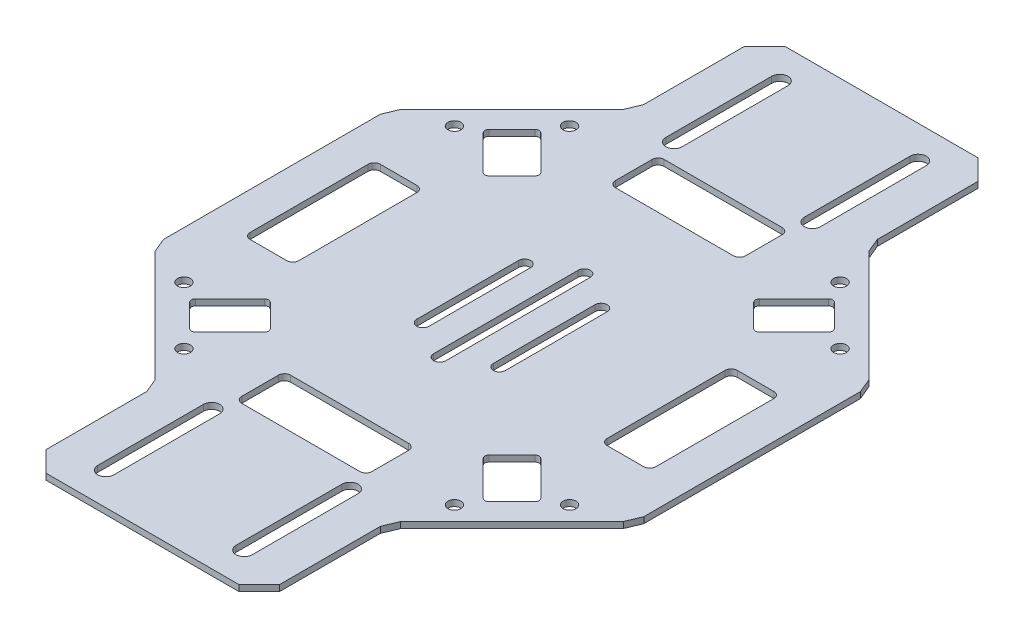
from build123d import *

# Parameters (mm, degrees)
SKETCH1_R           = 1.6
BOSS_EXTRUDE1_DEPTH = 0.75


with BuildPart() as part:
    # Sketch1 → Boss-Extrude1 (new, symmetric)
    with BuildSketch(Plane.XZ):
        Polygon((-59, 26.610173055), (-59, -26.610173055), (-57.535533906, -30.145706961), (-30.164466094, -57.516774773), (-28.7, -61.052308679), (-28.7, -85.8), (-23.7, -90.8), (23.7, -90.8), (28.7, -85.8), (28.7, -61.052308679), (30.164466094, -57.516774773), (57.535533906, -30.145706961), (59, -26.610173055), (59, 26.610173055), (57.535533906, 30.145706961), (30.164466094, 57.516774773), (28.7, 61.052308679), (28.7, 85.8), (23.7, 90.8), (-23.7, 90.8), (-28.7, 85.8), (-28.7, 61.052308679), (-30.164466094, 57.516774773), (-57.535533906, 30.145706961), align=None)
        with Locations(Location((-33.234018716, -47.376154339, 0), (0, 0, 90))):
            Circle(SKETCH1_R, mode=Mode.SUBTRACT)
        with Locations(Location((-47.376154339, -33.234018716, 0), (0, 0, 90))):
            Circle(SKETCH1_R, mode=Mode.SUBTRACT)
        with Locations(Location((-47.376154339, 33.234018716, 0), (0, 0, 90))):
            Circle(SKETCH1_R, mode=Mode.SUBTRACT)
        with Locations(Location((-33.234018716, 47.376154339, 0), (0, 0, 90))):
            Circle(SKETCH1_R, mode=Mode.SUBTRACT)
        with Locations(Location((33.234018716, 47.376154339, 0), (0, 0, 90))):
            Circle(SKETCH1_R, mode=Mode.SUBTRACT)
        with Locations(Location((47.376154339, 33.234018716, 0), (0, 0, 90))):
            Circle(SKETCH1_R, mode=Mode.SUBTRACT)
        with Locations(Location((47.376154339, -33.234018716, 0), (0, 0, 90))):
            Circle(SKETCH1_R, mode=Mode.SUBTRACT)
        with Locations(Location((33.234018716, -47.376154339, 0), (0, 0, 90))):
            Circle(SKETCH1_R, mode=Mode.SUBTRACT)
        with BuildLine():
            Line((-19, -82.8), (-19, -56.8))
            ThreePointArc((-19, -56.8), (-17, -54.8), (-15, -56.8))
            Line((-15, -56.8), (-15, -82.8))
            ThreePointArc((-15, -82.8), (-17, -84.8), (-19, -82.8))
        make_face(mode=Mode.SUBTRACT)
        with BuildLine():
            Line((19, 82.8), (19, 56.8))
            ThreePointArc((19, 56.8), (17, 54.8), (15, 56.8))
            Line((15, 56.8), (15, 82.8))
            ThreePointArc((15, 82.8), (17, 84.8), (19, 82.8))
        make_face(mode=Mode.SUBTRACT)
        with BuildLine():
            Line((-15, 82.8), (-15, 56.8))
            ThreePointArc((-15, 56.8), (-17, 54.8), (-19, 56.8))
            Line((-19, 56.8), (-19, 82.8))
            ThreePointArc((-19, 82.8), (-17, 84.8), (-15, 82.8))
        make_face(mode=Mode.SUBTRACT)
        with BuildLine():
            Line((-14.5, 51.9), (14.5, 51.9))
            ThreePointArc((14.5, 51.9), (15.560660172, 51.460660172), (16, 50.4))
            Line((16, 50.4), (16, 41.4))
            ThreePointArc((16, 41.4), (15.560660172, 40.339339828), (14.5, 39.9))
            Line((14.5, 39.9), (-14.5, 39.9))
            ThreePointArc((-14.5, 39.9), (-15.560660172, 40.339339828), (-16, 41.4))
            Line((-16, 41.4), (-16, 50.4))
            ThreePointArc((-16, 50.4), (-15.560660172, 51.460660172), (-14.5, 51.9))
        make_face(mode=Mode.SUBTRACT)
        with BuildLine():
            Line((16, -41.4), (16, -50.4))
            ThreePointArc((16, -50.4), (15.560660172, -51.460660172), (14.5, -51.9))
            Line((14.5, -51.9), (-14.5, -51.9))
            ThreePointArc((-14.5, -51.9), (-15.560660172, -51.460660172), (-16, -50.4))
            Line((-16, -50.4), (-16, -41.4))
            ThreePointArc((-16, -41.4), (-15.560660172, -40.339339828), (-14.5, -39.9))
            Line((-14.5, -39.9), (14.5, -39.9))
            ThreePointArc((14.5, -39.9), (15.560660172, -40.339339828), (16, -41.4))
        make_face(mode=Mode.SUBTRACT)
        with BuildLine():
            Line((19, -56.8), (19, -82.8))
            ThreePointArc((19, -82.8), (17, -84.8), (15, -82.8))
            Line((15, -82.8), (15, -56.8))
            ThreePointArc((15, -56.8), (17, -54.8), (19, -56.8))
        make_face(mode=Mode.SUBTRACT)
        with BuildLine():
            Line((-10.9, -12.5), (-10.9, 12.5))
            ThreePointArc((-10.9, 12.5), (-9.4, 14), (-7.9, 12.5))
            Line((-7.9, 12.5), (-7.9, -12.5))
            ThreePointArc((-7.9, -12.5), (-9.4, -14), (-10.9, -12.5))
        make_face(mode=Mode.SUBTRACT)
        with BuildLine():
            Line((10.9, 12.5), (10.9, -12.5))
            ThreePointArc((10.9, -12.5), (9.4, -14), (7.9, -12.5))
            Line((7.9, -12.5), (7.9, 12.5))
            ThreePointArc((7.9, 12.5), (9.4, 14), (10.9, 12.5))
        make_face(mode=Mode.SUBTRACT)
        with BuildLine():
            Line((-32.526911935, -26.870057685), (-26.870057685, -32.526911935))
            ThreePointArc((-26.870057685, -32.526911935), (-26.577164466, -33.234018716), (-26.870057685, -33.941125497))
            Line((-26.870057685, -33.941125497), (-35.355339059, -42.426406871))
            ThreePointArc((-35.355339059, -42.426406871), (-36.062445841, -42.71930009), (-36.769552622, -42.426406871))
            Line((-36.769552622, -42.426406871), (-42.426406871, -36.769552622))
            ThreePointArc((-42.426406871, -36.769552622), (-42.71930009, -36.062445841), (-42.426406871, -35.355339059))
            Line((-42.426406871, -35.355339059), (-33.941125497, -26.870057685))
            ThreePointArc((-33.941125497, -26.870057685), (-33.234018716, -26.577164466), (-32.526911935, -26.870057685))
        make_face(mode=Mode.SUBTRACT)
        with BuildLine():
            Line((-26.870057685, 32.526911935), (-32.526911935, 26.870057685))
            ThreePointArc((-32.526911935, 26.870057685), (-33.234018716, 26.577164466), (-33.941125497, 26.870057685))
            Line((-33.941125497, 26.870057685), (-42.426406871, 35.355339059))
            ThreePointArc((-42.426406871, 35.355339059), (-42.71930009, 36.062445841), (-42.426406871, 36.769552622))
            Line((-42.426406871, 36.769552622), (-36.769552622, 42.426406871))
            ThreePointArc((-36.769552622, 42.426406871), (-36.062445841, 42.71930009), (-35.355339059, 42.426406871))
            Line((-35.355339059, 42.426406871), (-26.870057685, 33.941125497))
            ThreePointArc((-26.870057685, 33.941125497), (-26.577164466, 33.234018716), (-26.870057685, 32.526911935))
        make_face(mode=Mode.SUBTRACT)
        with BuildLine():
            Line((48.35, -16), (39.35, -16))
            ThreePointArc((39.35, -16), (38.289339828, -15.560660172), (37.85, -14.5))
            Line((37.85, -14.5), (37.85, 14.5))
            ThreePointArc((37.85, 14.5), (38.289339828, 15.560660172), (39.35, 16))
            Line((39.35, 16), (48.35, 16))
            ThreePointArc((48.35, 16), (49.410660172, 15.560660172), (49.85, 14.5))
            Line((49.85, 14.5), (49.85, -14.5))
            ThreePointArc((49.85, -14.5), (49.410660172, -15.560660172), (48.35, -16))
        make_face(mode=Mode.SUBTRACT)
        with BuildLine():
            Line((-39.35, -16), (-48.35, -16))
            ThreePointArc((-48.35, -16), (-49.410660172, -15.560660172), (-49.85, -14.5))
            Line((-49.85, -14.5), (-49.85, 14.5))
            ThreePointArc((-49.85, 14.5), (-49.410660172, 15.560660172), (-48.35, 16))
            Line((-48.35, 16), (-39.35, 16))
            ThreePointArc((-39.35, 16), (-38.289339828, 15.560660172), (-37.85, 14.5))
            Line((-37.85, 14.5), (-37.85, -14.5))
            ThreePointArc((-37.85, -14.5), (-38.289339828, -15.560660172), (-39.35, -16))
        make_face(mode=Mode.SUBTRACT)
        with BuildLine():
            Line((26.870057685, -32.526911935), (32.526911935, -26.870057685))
            ThreePointArc((32.526911935, -26.870057685), (33.234018716, -26.577164466), (33.941125497, -26.870057685))
            Line((33.941125497, -26.870057685), (42.426406871, -35.355339059))
            ThreePointArc((42.426406871, -35.355339059), (42.71930009, -36.062445841), (42.426406871, -36.769552622))
            Line((42.426406871, -36.769552622), (36.769552622, -42.426406871))
            ThreePointArc((36.769552622, -42.426406871), (36.062445841, -42.71930009), (35.355339059, -42.426406871))
            Line((35.355339059, -42.426406871), (26.870057685, -33.941125497))
            ThreePointArc((26.870057685, -33.941125497), (26.577164466, -33.234018716), (26.870057685, -32.526911935))
        make_face(mode=Mode.SUBTRACT)
        with BuildLine():
            Line((32.526911935, 26.870057685), (26.870057685, 32.526911935))
            ThreePointArc((26.870057685, 32.526911935), (26.577164466, 33.234018716), (26.870057685, 33.941125497))
            Line((26.870057685, 33.941125497), (35.355339059, 42.426406871))
            ThreePointArc((35.355339059, 42.426406871), (36.062445841, 42.71930009), (36.769552622, 42.426406871))
            Line((36.769552622, 42.426406871), (42.426406871, 36.769552622))
            ThreePointArc((42.426406871, 36.769552622), (42.71930009, 36.062445841), (42.426406871, 35.355339059))
            Line((42.426406871, 35.355339059), (33.941125497, 26.870057685))
            ThreePointArc((33.941125497, 26.870057685), (33.234018716, 26.577164466), (32.526911935, 26.870057685))
        make_face(mode=Mode.SUBTRACT)
        with BuildLine():
            Line((1.5, 17.75), (1.5, -17.75))
            ThreePointArc((1.5, -17.75), (0, -19.25), (-1.5, -17.75))
            Line((-1.5, -17.75), (-1.5, 17.75))
            ThreePointArc((-1.5, 17.75), (0, 19.25), (1.5, 17.75))
        make_face(mode=Mode.SUBTRACT)
    extrude(amount=BOSS_EXTRUDE1_DEPTH, both=True)


solid = part.part
